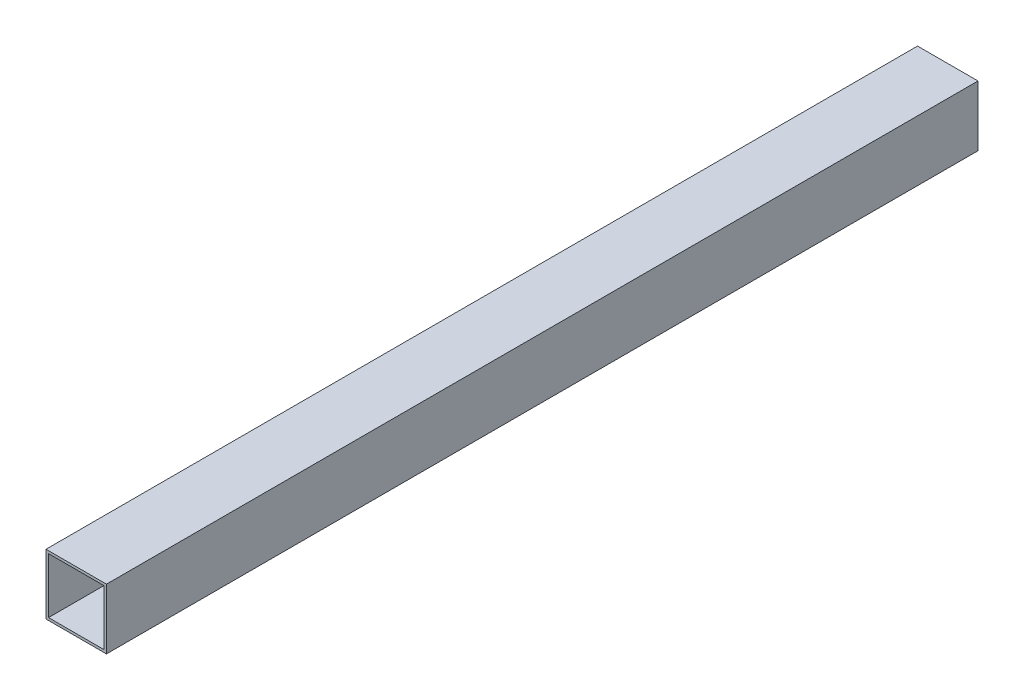
from build123d import *

# Parameters (mm, degrees)
SKETCH2_W           = 76.2
SKETCH2_H           = 76.2
BOSS_EXTRUDE1_DEPTH = 1098.55
SKETCH3_W           = 69.85
SKETCH3_H           = 69.85
CUT_EXTRUDE1_DEPTH  = 1098.55


with BuildPart() as part:
    # Sketch2 → Boss-Extrude1 (new body)
    with BuildSketch(Plane.XY):
        with Locations((-2.629709588, -19.469024582)):
            Rectangle(SKETCH2_W, SKETCH2_H)
    extrude(amount=BOSS_EXTRUDE1_DEPTH)

    # Sketch3 → Cut-Extrude1 (cut)
    with BuildSketch(Plane.XY.offset(1098.55)):
        with Locations((-2.629709588, -19.469024582)):
            Rectangle(SKETCH3_W, SKETCH3_H)
    extrude(amount=-CUT_EXTRUDE1_DEPTH, mode=Mode.SUBTRACT)


solid = part.part
